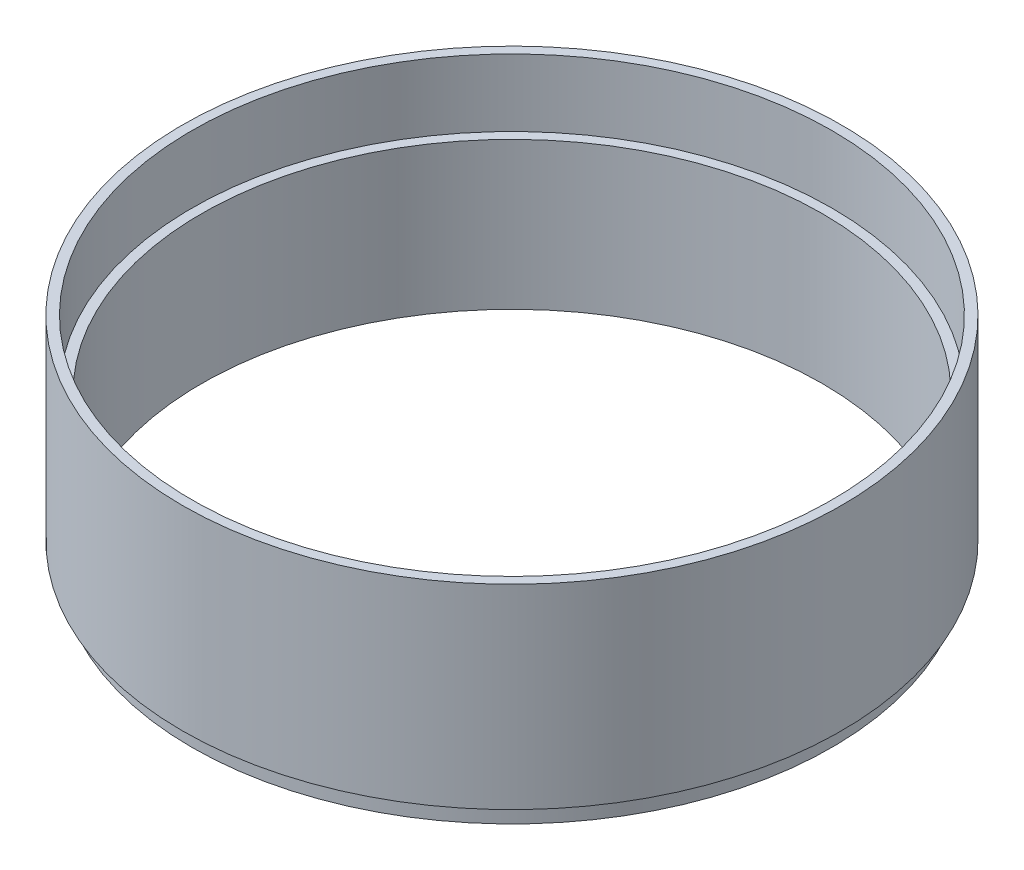
from build123d import *

# Parameters (mm, degrees)
SKETCH_1_R      = 100
SKETCH_1_R_2    = 97
EXTRUDE_1_DEPTH = 6
SKETCH_2_R      = 103
SKETCH_2_R_2    = 97
EXTRUDE_2_DEPTH = 40
SKETCH_3_R      = 103
SKETCH_3_R_2    = 100
EXTRUDE_3_DEPTH = 21


with BuildPart() as part:
    # 草图1 → 凸台-拉伸1 (new body)
    with BuildSketch(Plane(origin=(0, 0, 0), x_dir=(1, 0, 0), z_dir=(0, 1, 0))):
        with Locations(Location((0, 0, 0), (0, 0, 270))):
            Circle(SKETCH_1_R)
        with Locations(Location((0, 0, 0), (0, 0, 270))):
            Circle(SKETCH_1_R_2, mode=Mode.SUBTRACT)
    extrude(amount=EXTRUDE_1_DEPTH)

    # 草图2 → 凸台-拉伸2 (add)
    with BuildSketch(Plane(origin=(0, 6, 0), x_dir=(1, 0, 0), z_dir=(0, 1, 0))):
        with Locations(Location((0, 0, 0), (0, 0, 270))):
            Circle(SKETCH_2_R)
        with Locations(Location((0, 0, 0), (0, 0, 270))):
            Circle(SKETCH_2_R_2, mode=Mode.SUBTRACT)
    extrude(amount=EXTRUDE_2_DEPTH)

    # 草图3 → 凸台-拉伸3 (add)
    with BuildSketch(Plane(origin=(0, 46, 0), x_dir=(1, 0, 0), z_dir=(0, 1, 0))):
        with Locations(Location((0, 0, 0), (0, 0, 270))):
            Circle(SKETCH_3_R)
        with Locations(Location((0, 0, 0), (0, 0, 270))):
            Circle(SKETCH_3_R_2, mode=Mode.SUBTRACT)
    extrude(amount=EXTRUDE_3_DEPTH)


solid = part.part
